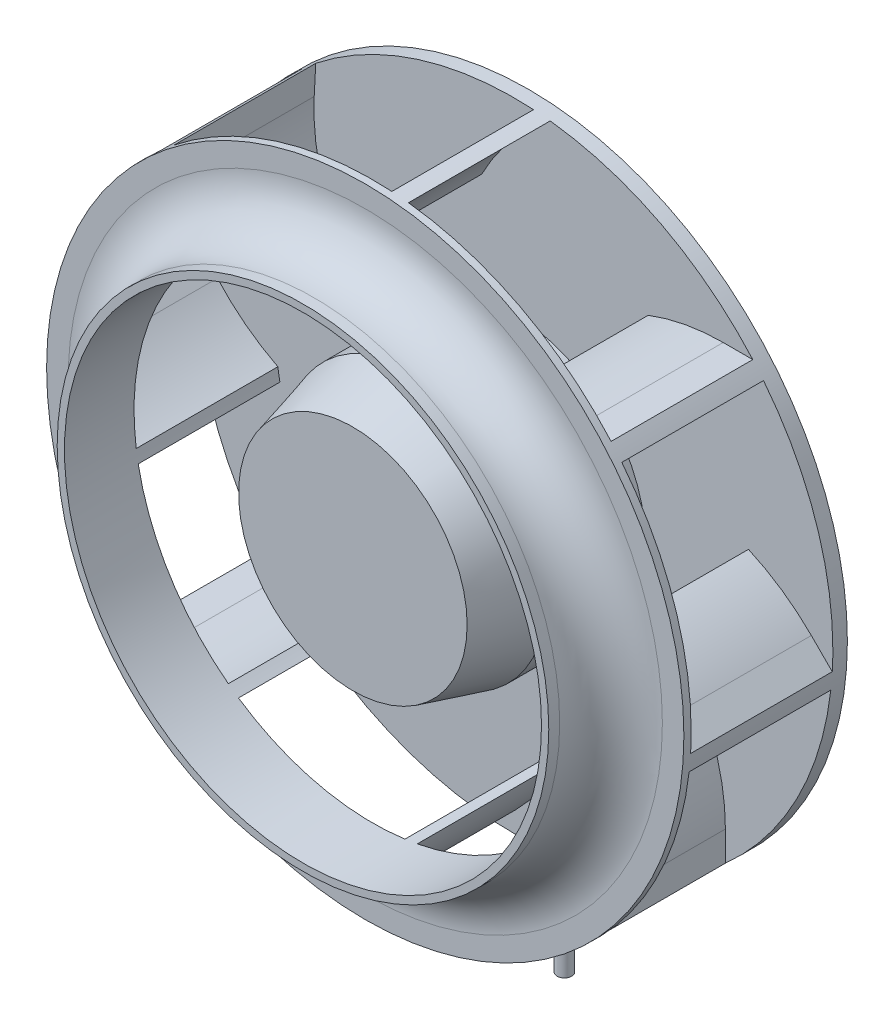
from build123d import *

# Parameters (mm, degrees)
CUT_EXTRUDE1_DEPTH = 38.90367873
CIRPATTERN1_COUNT  = 8


with BuildPart() as part:
    # Sketch1 → Revolve1 (revolve)
    with BuildSketch(Plane(origin=(0, 0, 0), x_dir=(0, 0, -1), z_dir=(1, 0, 0)), mode=Mode.PRIVATE) as revolve1_sk:
        with BuildLine():
            Line((0, 0), (0, 36))
            Line((0, 36), (-7, 36))
            Line((-7, 36), (-7, 87.5))
            Line((-7, 87.5), (-51.90367873, 87.5))
            Line((-51.90367873, 87.5), (-51.90367873, 81.59632127))
            ThreePointArc((-51.90367873, 81.59632127), (-56.03239564, 71.62871691), (-66, 67.5))
            Line((-66, 67.5), (-69, 67.5))
            Line((-69, 67.5), (-69, 65.5))
            Line((-69, 65.5), (-11, 65.5))
            Line((-11, 65.5), (-11, 36))
            Line((-11, 36), (-38.057788399, 36))
            Line((-38.057788399, 36), (-55.3, 31.379963326))
            Line((-55.3, 31.379963326), (-55.3, 0))
            Line((-55.3, 0), (0, 0))
        make_face()
    revolve(revolve1_sk.sketch.rotate(Axis((0, 0, 0), (0, 0, -1)), 90), axis=Axis((0, 0, 0), (0, 0, -1)))

    # Sketch2 → Cut-Extrude1 (cut)
    with BuildSketch(Plane.XY.offset(11)):
        with BuildLine():
            Line((75.568573924, 58), (57.393027841, 58))
            ThreePointArc((57.393027841, 58), (32.84389058, 52.485045903), (13.012395116, 37))
            Line((13.012395116, 37), (-15.118999196, 37))
            ThreePointArc((-15.118999196, 37), (-10.556616441, 61.348122111), (3.84175649, 81.505831398))
            Line((3.84175649, 81.505831398), (17.348819511, 93.667645569))
            Line((17.348819511, 93.667645569), (75.568573924, 58))
        make_face()
    cut_extrude1 = extrude(amount=CUT_EXTRUDE1_DEPTH, mode=Mode.SUBTRACT)

    # CirPattern1: Cut-Extrude1 ×8 about axis
    cirpattern1_axis = Axis((0, 0, 0), (0, 0, 1))
    for i in range(1, CIRPATTERN1_COUNT):
        add(cut_extrude1.rotate(cirpattern1_axis, i * 360 / CIRPATTERN1_COUNT), mode=Mode.SUBTRACT)

    # Sketch3 → Revolve2 (revolve)
    with BuildSketch(Plane(origin=(0, 0, 0), x_dir=(0, 0, -1), z_dir=(1, 0, 0))):
        Polygon((5.8, -29.649658317), (5.8, -53), (4.8, -54), (4.8, -127.307937006), (2.8, -127.307937006), (2.8, -29.649658317), align=None)
    revolve(axis=Axis((0, -29.649658317, -2.8), (0, 1, 0)))


solid = part.part
